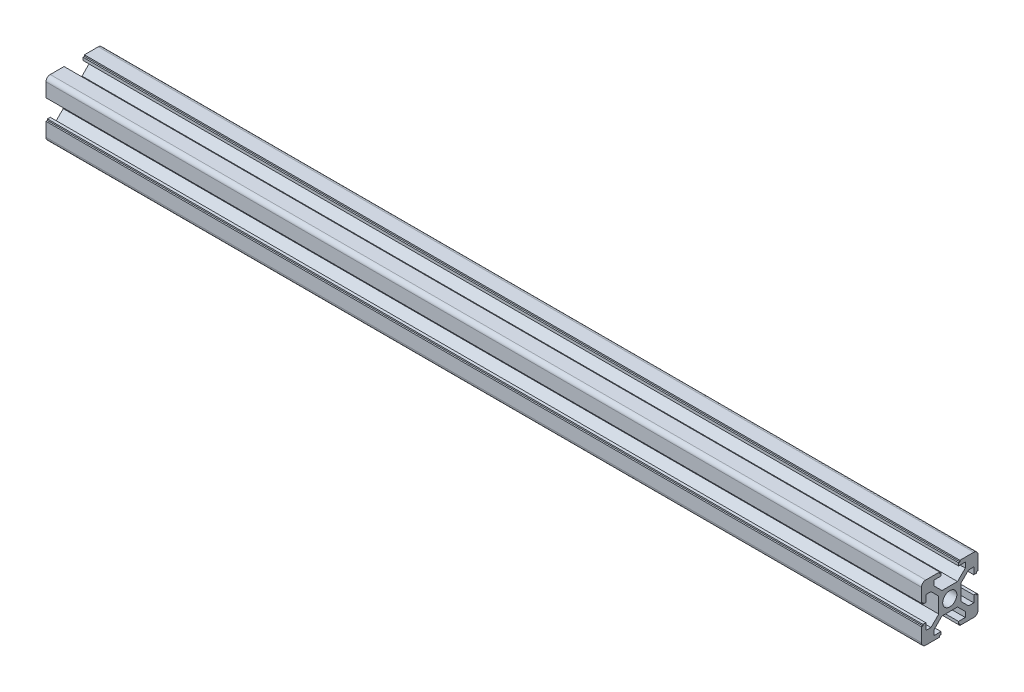
from build123d import *

# Parameters (mm, degrees)
SKETCH1_R                = 2.5
F_20_X_20_X_R1_5_1_DEPTH = 310


with BuildPart() as part:
    # Sketch1 → 铝型材 20 X 20 X R1.5(1) (new body)
    with BuildSketch(Plane(origin=(0, 0, 0), x_dir=(0, 0, -1), z_dir=(1, 0, 0))):
        with BuildLine():
            Line((-3.6, 10), (-3.6, 9.5))
            Line((-3.6, 9.5), (-3.1, 9.5))
            Line((-3.1, 9.5), (-3.1, 8.5))
            Line((-3.1, 8.5), (-5.5, 8.5))
            Line((-5.5, 8.5), (-5.5, 6.65))
            Line((-5.5, 6.65), (-2.75, 3.9))
            Line((-2.75, 3.9), (2.75, 3.9))
            Line((2.75, 3.9), (5.5, 6.65))
            Line((5.5, 6.65), (5.5, 8.5))
            Line((5.5, 8.5), (3.1, 8.5))
            Line((3.1, 8.5), (3.1, 9.5))
            Line((3.1, 9.5), (3.6, 9.5))
            Line((3.6, 9.5), (3.6, 10))
            Line((3.6, 10), (8.5, 10))
            ThreePointArc((8.5, 10), (9.560660172, 9.560660172), (10, 8.5))
            Line((10, 8.5), (10, 3.6))
            Line((10, 3.6), (9.5, 3.6))
            Line((9.5, 3.6), (9.5, 3.1))
            Line((9.5, 3.1), (8.5, 3.1))
            Line((8.5, 3.1), (8.5, 5.5))
            Line((8.5, 5.5), (6.65, 5.5))
            Line((6.65, 5.5), (3.9, 2.75))
            Line((3.9, 2.75), (3.9, -2.75))
            Line((3.9, -2.75), (6.65, -5.5))
            Line((6.65, -5.5), (8.5, -5.5))
            Line((8.5, -5.5), (8.5, -3.1))
            Line((8.5, -3.1), (9.5, -3.1))
            Line((9.5, -3.1), (9.5, -3.6))
            Line((9.5, -3.6), (10, -3.6))
            Line((10, -3.6), (10, -8.5))
            ThreePointArc((10, -8.5), (9.560660172, -9.560660172), (8.5, -10))
            Line((8.5, -10), (3.6, -10))
            Line((3.6, -10), (3.6, -9.5))
            Line((3.6, -9.5), (3.1, -9.5))
            Line((3.1, -9.5), (3.1, -8.5))
            Line((3.1, -8.5), (5.5, -8.5))
            Line((5.5, -8.5), (5.5, -6.65))
            Line((5.5, -6.65), (2.75, -3.9))
            Line((2.75, -3.9), (-2.75, -3.9))
            Line((-2.75, -3.9), (-5.5, -6.65))
            Line((-5.5, -6.65), (-5.5, -8.5))
            Line((-5.5, -8.5), (-3.1, -8.5))
            Line((-3.1, -8.5), (-3.1, -9.5))
            Line((-3.1, -9.5), (-3.6, -9.5))
            Line((-3.6, -9.5), (-3.6, -10))
            Line((-3.6, -10), (-8.5, -10))
            ThreePointArc((-8.5, -10), (-9.560660172, -9.560660172), (-10, -8.5))
            Line((-10, -8.5), (-10, -3.6))
            Line((-10, -3.6), (-9.5, -3.6))
            Line((-9.5, -3.6), (-9.5, -3.1))
            Line((-9.5, -3.1), (-8.5, -3.1))
            Line((-8.5, -3.1), (-8.5, -5.5))
            Line((-8.5, -5.5), (-6.65, -5.5))
            Line((-6.65, -5.5), (-3.9, -2.75))
            Line((-3.9, -2.75), (-3.9, 2.75))
            Line((-3.9, 2.75), (-6.65, 5.5))
            Line((-6.65, 5.5), (-8.5, 5.5))
            Line((-8.5, 5.5), (-8.5, 3.1))
            Line((-8.5, 3.1), (-9.5, 3.1))
            Line((-9.5, 3.1), (-9.5, 3.6))
            Line((-9.5, 3.6), (-10, 3.6))
            Line((-10, 3.6), (-10, 8.5))
            ThreePointArc((-10, 8.5), (-9.560660172, 9.560660172), (-8.5, 10))
            Line((-8.5, 10), (-3.6, 10))
        make_face()
        Circle(SKETCH1_R, mode=Mode.SUBTRACT)
    extrude(amount=F_20_X_20_X_R1_5_1_DEPTH)


solid = part.part
